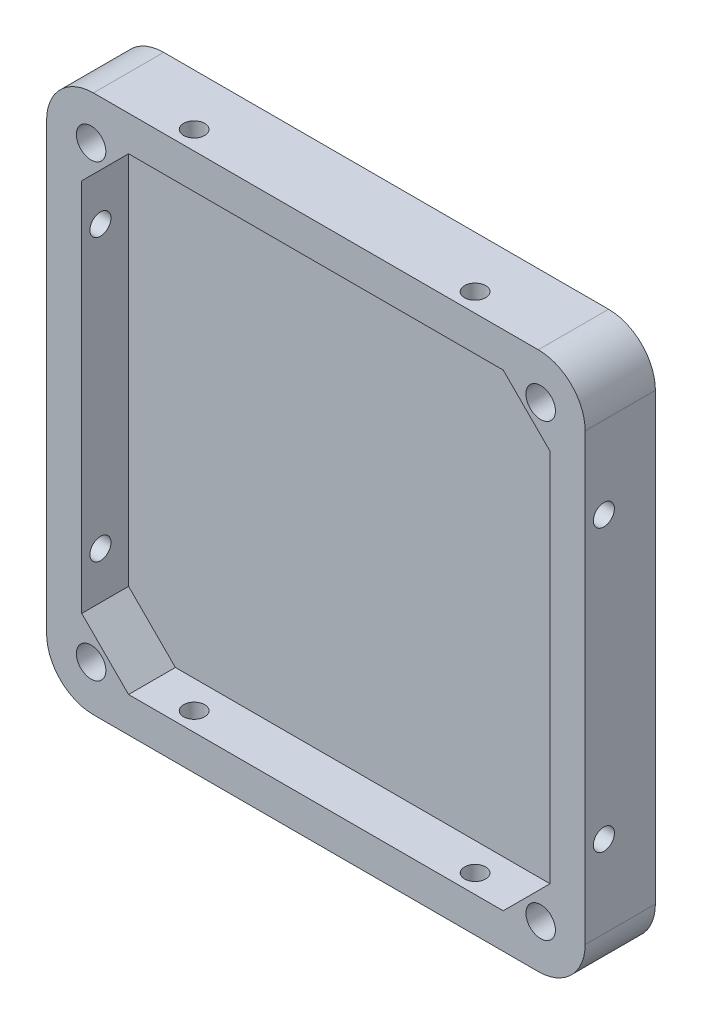
from build123d import *

# Parameters (mm, degrees)
SKETCH1_W                                  = 115
SKETCH1_H                                  = 115
BOSS_EXTRUDE1_DEPTH                        = 7.5
FILLET1_R                                  = 10
SKETCH2_W                                  = 100
SKETCH2_H                                  = 100
CUT_EXTRUDE1_DEPTH                         = 10
CHAMFER1_SIZE                              = 10
SKETCH3_R                                  = 3.15
CUT_EXTRUDE2_DEPTH                         = 30
MIRROR1_AT_THE_SECOND_PLANE_COPY_1_SKETC_R = 3.15
MIRROR1_AT_THE_SECOND_PLANE_COPY_1_DEPTH   = 30
SKETCH4_R                                  = 2.25
CUT_EXTRUDE3_DEPTH                         = 130
SKETCH6_R                                  = 2.25
CUT_EXTRUDE4_DEPTH                         = 129.792468724


with BuildPart() as part:
    # Sketch1 → Boss-Extrude1 (new, symmetric)
    with BuildSketch(Plane.XY):
        Rectangle(SKETCH1_W, SKETCH1_H)
    extrude(amount=BOSS_EXTRUDE1_DEPTH, both=True)

    # Fillet1
    fillet1_edges = [part.edges().sort_by_distance(p)[0] for p in [
        (-57.5, 57.5, 0),
        (57.5, 57.5, 0),
        (57.5, -57.5, 0),
        (-57.5, -57.5, 0),
    ]]
    fillet(fillet1_edges, radius=FILLET1_R)

    # Sketch2 → Cut-Extrude1 (cut)
    with BuildSketch(Plane.XY.offset(7.5)):
        Rectangle(SKETCH2_W, SKETCH2_H)
    extrude(amount=-CUT_EXTRUDE1_DEPTH, mode=Mode.SUBTRACT)

    # Chamfer1
    chamfer1_edges = [part.edges().sort_by_distance(p)[0] for p in [
        (-50, -50, 2.5),
        (-50, 50, 2.5),
        (50, 50, 2.5),
        (50, -50, 2.5),
    ]]
    chamfer(chamfer1_edges, length=CHAMFER1_SIZE)

    # Sketch3 → Cut-Extrude2 (cut)
    with BuildSketch(Plane.XY.offset(7.5)):
        with Locations((-48, 48)):
            Circle(SKETCH3_R)
    cut_extrude2 = extrude(amount=-CUT_EXTRUDE2_DEPTH, mode=Mode.SUBTRACT)

    # Mirror1: Cut-Extrude2 across plane
    add(cut_extrude2.mirror(Plane(origin=(0, 0, 0), x_dir=(0, 0, 1), z_dir=(1, 0, 0))), mode=Mode.SUBTRACT)

    # Mirror1 at the second plane: Cut-Extrude2 across plane
    add(cut_extrude2.mirror(Plane.ZX), mode=Mode.SUBTRACT)

    # Mirror1 at the second plane copy 1 sketc → Mirror1 at the second plane copy 1 (cut)
    with BuildSketch(Plane(origin=(0, 0, 7.5), x_dir=(-1, 0, 0), z_dir=(0, 0, 1))):
        with Locations((-48, 48)):
            Circle(MIRROR1_AT_THE_SECOND_PLANE_COPY_1_SKETC_R)
    extrude(amount=-MIRROR1_AT_THE_SECOND_PLANE_COPY_1_DEPTH, mode=Mode.SUBTRACT)

    # Sketch4 → Cut-Extrude3 (cut)
    with BuildSketch(Plane(origin=(57.5, 0, 0), x_dir=(0, 0, -1), z_dir=(1, 0, 0))):
        with Locations((-3.5, 30)):
            Circle(SKETCH4_R)
    cut_extrude3 = extrude(amount=-CUT_EXTRUDE3_DEPTH, mode=Mode.SUBTRACT)

    # Mirror2: Cut-Extrude3 across plane
    add(cut_extrude3.mirror(Plane.ZX), mode=Mode.SUBTRACT)

    # Sketch6 → Cut-Extrude4 (cut, through all)
    with BuildSketch(Plane(origin=(0, 57.5, 0), x_dir=(1, 0, 0), z_dir=(0, 1, 0))):
        with Locations(Location((-30, -3.5, 0), (0, 0, 180))):
            Circle(SKETCH6_R)
    cut_extrude4 = extrude(amount=-CUT_EXTRUDE4_DEPTH, mode=Mode.SUBTRACT)

    # Mirror3: Cut-Extrude4 across plane
    add(cut_extrude4.mirror(Plane(origin=(0, 0, 0), x_dir=(0, 0, 1), z_dir=(1, 0, 0))), mode=Mode.SUBTRACT)


solid = part.part
